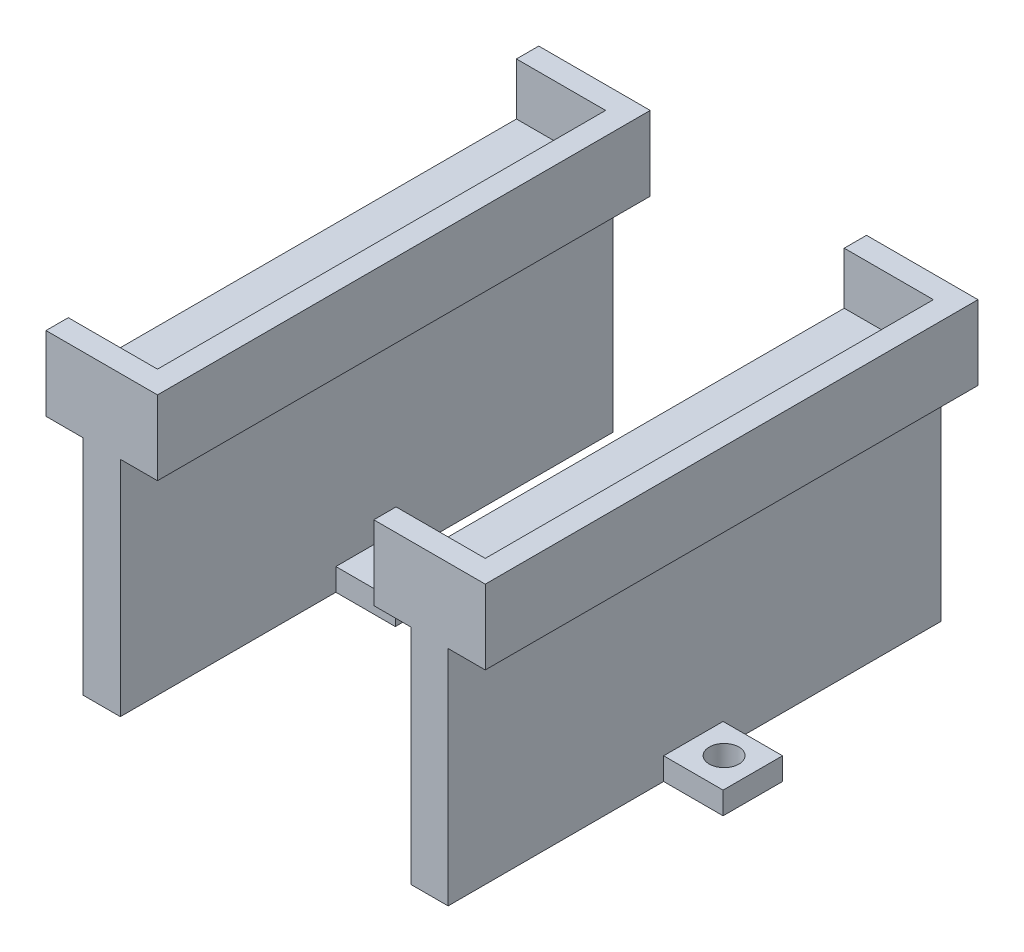
from build123d import *

# Parameters (mm, degrees)
SKETCH1_W               = 177
SKETCH1_H               = 66.3
BOSS_EXTRUDE1_DEPTH     = 10
CUT_EXTRUDE1_DEPTH      = 120.991628317
CUT_EXTRUDE1_DEPTH_BACK = 7
SKETCH2_W               = 171
SKETCH2_H               = 60.3
SKETCH3_W               = 5
SKETCH3_H               = 66.3
BOSS_EXTRUDE2_DEPTH     = 30
SKETCH4_W               = 147
SKETCH4_H               = 66.3
CUT_EXTRUDE2_DEPTH      = 30
SKETCH5_W               = 8
SKETCH5_H               = 8
SKETCH5_R               = 1.899919422
SKETCH5_R_2             = 1.99416254
BOSS_EXTRUDE3_DEPTH     = 3
SKETCH6_W               = 53.200668984
SKETCH6_H               = 118.475248661
CUT_EXTRUDE3_DEPTH      = 137.93353889


with BuildPart() as part:
    # Sketch1 → Boss-Extrude1 (new body)
    with BuildSketch(Plane(origin=(0, 0, 0), x_dir=(1, 0, 0), z_dir=(0, 1, 0))):
        with Locations((-24.496138181, -5.963471112)):
            Rectangle(SKETCH1_W, SKETCH1_H)
    extrude(amount=BOSS_EXTRUDE1_DEPTH)

    # Sketch2 → Cut-Extrude1 (cut, two sides: drawn at the far end of the back side and taken through both)
    with BuildSketch(Plane(origin=(0, 10, 0), x_dir=(1, 0, 0), z_dir=(0, 1, 0)).offset(-CUT_EXTRUDE1_DEPTH_BACK)):
        with Locations((-24.496138181, -5.963471112)):
            Rectangle(SKETCH2_W, SKETCH2_H)
    extrude(amount=CUT_EXTRUDE1_DEPTH + CUT_EXTRUDE1_DEPTH_BACK, mode=Mode.SUBTRACT)

    # Sketch3 → Boss-Extrude2 (add)
    with BuildSketch(Plane.XZ):
        with Locations((-105.496138181, 5.963471112)):
            Rectangle(SKETCH3_W, SKETCH3_H)
        with Locations((56.503861819, 5.963471112)):
            Rectangle(SKETCH3_W, SKETCH3_H)
    extrude(amount=BOSS_EXTRUDE2_DEPTH)

    # Sketch4 → Cut-Extrude2 (cut)
    with BuildSketch(Plane.XZ):
        with Locations((-24.496138181, 5.963471112)):
            Rectangle(SKETCH4_W, SKETCH4_H)
    extrude(amount=-CUT_EXTRUDE2_DEPTH, mode=Mode.SUBTRACT)


with BuildPart() as cut_extrude2_piece_1:
    # of the separate pieces the step leaves, piece 1, a body of its own (cut_extrude2_pieces)
    add(part.part.solids().sort_by_distance((-97.996138181, 0, 39.113471112))[0])



with BuildPart() as cut_extrude2_piece_2:
    # of the separate pieces the step leaves, piece 2, a body of its own (cut_extrude2_pieces)
    add(part.part.solids().sort_by_distance((64.003861819, 0, 39.113471112))[0])


with BuildPart() as cut_extrude2_piece_1_1:
    add(cut_extrude2_piece_1.part)

    add(cut_extrude2_piece_2.part)  # Boss-Extrude3 merges Cut-Extrude2 piece 2
    # Sketch5 → Boss-Extrude3 (add)
    # profile 1 of 2: a face of its own
    with BuildSketch(Plane.XZ.offset(30)):
        with Locations((-111.996138181, 6.113471112)):
            Rectangle(SKETCH5_W, SKETCH5_H)
        with Locations(Location((-111.976969615, 5.996435965, 0), (0, 0, 270))):
            Circle(SKETCH5_R, mode=Mode.SUBTRACT)
    # profile 2 of 2: a face of its own
    with BuildSketch(Plane.XZ.offset(30)):
        with Locations((63.003861819, 6.113471112)):
            Rectangle(SKETCH5_W, SKETCH5_H)
        with Locations(Location((63.046032676, 6.021165831, 0), (0, 0, 270))):
            Circle(SKETCH5_R_2, mode=Mode.SUBTRACT)
    extrude(amount=-BOSS_EXTRUDE3_DEPTH)

    # Sketch6 → Cut-Extrude3 (cut, through all)
    with BuildSketch(Plane(origin=(0, 0, -27.186528888), x_dir=(-1, 0, 0), z_dir=(0, 0, -1))):
        with Locations((95.157985418, 15.958745635)):
            Rectangle(SKETCH6_W, SKETCH6_H)
    extrude(amount=-CUT_EXTRUDE3_DEPTH, mode=Mode.SUBTRACT)


with BuildPart() as body_2:
    # Body-Move/Copy1: copy of Cut-Extrude2 piece 1
    add(cut_extrude2_piece_1_1.part.moved(Location((44.104133086, 0, 0))))


solid = Compound([cut_extrude2_piece_1_1.part, body_2.part])
